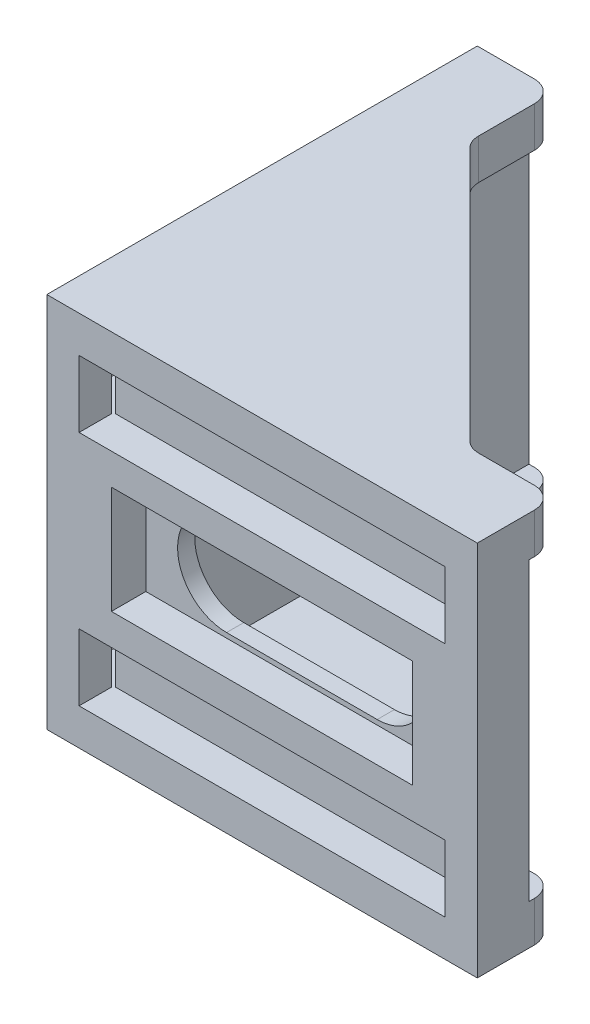
from build123d import *

# Parameters (mm, degrees)
EXTRUDE_1_DEPTH     = 17.5
SKETCH_2_W          = 35.2
SKETCH_2_H          = 27.5
CUT_EXTRUDE_1_DEPTH = 35.2
CUT_EXTRUDE_2_DEPTH = 60.213596412
CUT_EXTRUDE_3_DEPTH = 60.213596412
SKETCH_5_W          = 34
SKETCH_5_H          = 6.2
SKETCH_5_W_2        = 28
SKETCH_5_H_2        = 10
CUT_EXTRUDE_4_DEPTH = 3.2
SKETCH_6_W          = 34
SKETCH_6_H          = 6.2
SKETCH_6_W_2        = 28
SKETCH_6_H_2        = 10
CUT_EXTRUDE_5_DEPTH = 3.2
FILLET_1_R          = 2


with BuildPart() as part:
    # Эскиз1 → Бобышка-Вытянуть1 (new, symmetric)
    with BuildSketch(Plane(origin=(0, 0, 0), x_dir=(1, 0, 0), z_dir=(0, 1, 0))):
        with BuildLine():
            Line((0, 40), (0, 0))
            Line((0, 0), (40, 0))
            Line((40, 0), (40, 5.3))
            ThreePointArc((40, 5.3), (39.414213562, 6.714213562), (38, 7.3))
            Line((38, 7.3), (32, 7.3))
            Line((32, 7.3), (7.3, 32))
            Line((7.3, 32), (7.3, 38))
            ThreePointArc((7.3, 38), (6.714213562, 39.414213562), (5.3, 40))
            Line((5.3, 40), (0, 40))
        make_face()
    extrude(amount=EXTRUDE_1_DEPTH, both=True)

    # Эскиз2 → Вырез-Вытянуть1 (cut)
    with BuildSketch(Plane(origin=(0, 0, -40), x_dir=(-1, 0, 0), z_dir=(0, 0, -1))):
        with Locations((-22.4, 0)):
            Rectangle(SKETCH_2_W, SKETCH_2_H)
    extrude(amount=-CUT_EXTRUDE_1_DEPTH, mode=Mode.SUBTRACT)

    # Эскиз3 → Вырез-Вытянуть2 (cut, through all)
    with BuildSketch(Plane.XY):
        with BuildLine():
            Line((13.5, 4.55), (27.5, 4.55))
            ThreePointArc((27.5, 4.55), (32.05, 0), (27.5, -4.55))
            Line((27.5, -4.55), (13.5, -4.55))
            ThreePointArc((13.5, -4.55), (8.95, 0), (13.5, 4.55))
        make_face()
    extrude(amount=-CUT_EXTRUDE_2_DEPTH, mode=Mode.SUBTRACT)

    # Эскиз4 → Вырез-Вытянуть3 (cut, through all)
    with BuildSketch(Plane.ZY):
        with BuildLine():
            Line((-27.5, 4.55), (-13.5, 4.55))
            ThreePointArc((-13.5, 4.55), (-8.95, 0), (-13.5, -4.55))
            Line((-13.5, -4.55), (-27.5, -4.55))
            ThreePointArc((-27.5, -4.55), (-32.05, 0), (-27.5, 4.55))
        make_face()
    extrude(amount=-CUT_EXTRUDE_3_DEPTH, mode=Mode.SUBTRACT)

    # Эскиз5 → Вырез-Вытянуть4 (cut)
    with BuildSketch(Plane.ZY):
        with Locations((-20, 11)):
            Rectangle(SKETCH_5_W, SKETCH_5_H)
        with Locations((-20, -11)):
            Rectangle(SKETCH_5_W, SKETCH_5_H)
        with Locations((-20, 0)):
            Rectangle(SKETCH_5_W_2, SKETCH_5_H_2)
    extrude(amount=-CUT_EXTRUDE_4_DEPTH, mode=Mode.SUBTRACT)

    # Эскиз6 → Вырез-Вытянуть5 (cut)
    with BuildSketch(Plane.XY):
        with Locations((20, 11)):
            Rectangle(SKETCH_6_W, SKETCH_6_H)
        with Locations((20, -11)):
            Rectangle(SKETCH_6_W, SKETCH_6_H)
        with Locations((20, 0)):
            Rectangle(SKETCH_6_W_2, SKETCH_6_H_2)
    extrude(amount=-CUT_EXTRUDE_5_DEPTH, mode=Mode.SUBTRACT)

    # Скругление1
    fillet_1_edges = [part.edges().sort_by_distance(p)[0] for p in [
        (7.3, 15.625, -32),
        (32, 15.625, -7.3),
        (7.3, -15.625, -32),
        (32, -15.625, -7.3),
    ]]
    fillet(fillet_1_edges, radius=FILLET_1_R)


solid = part.part
